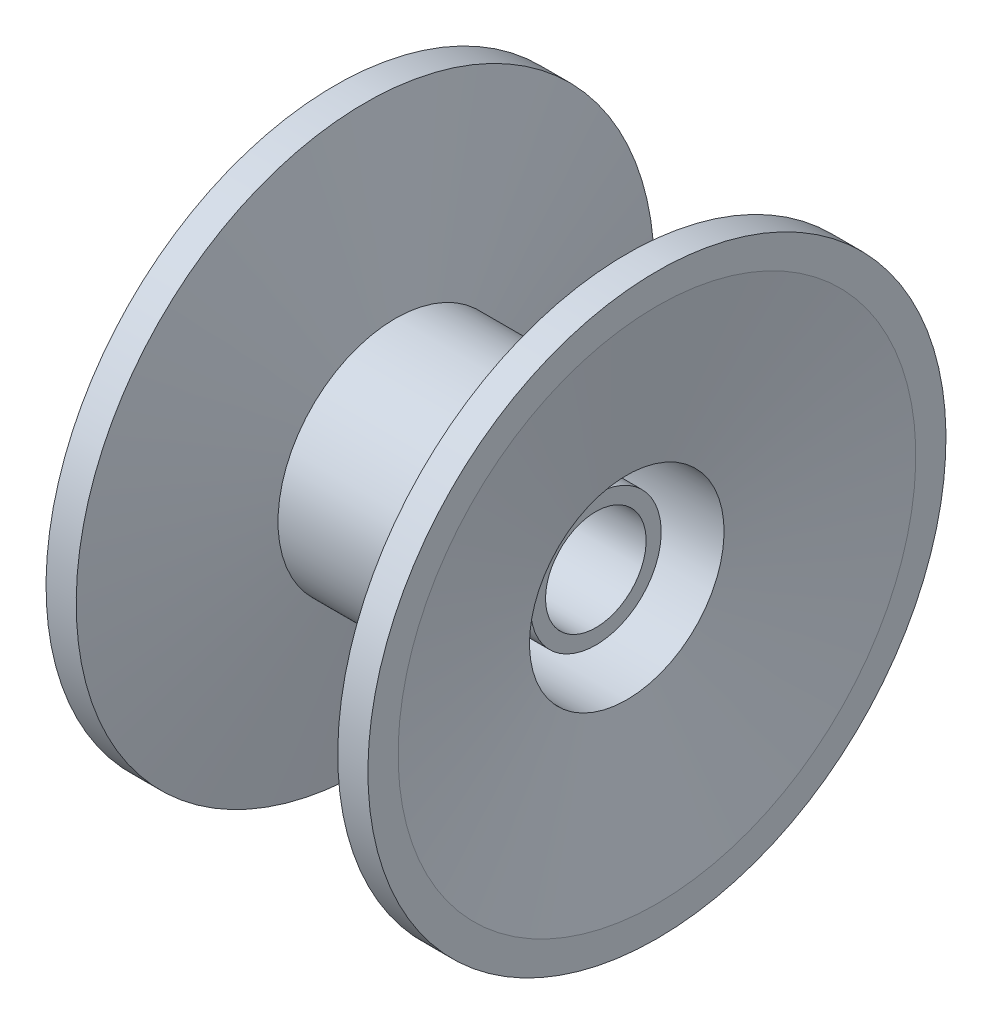
from build123d import *


with BuildPart() as part:
    # Sketch1 → Revolve1 (revolve)
    with BuildSketch(Plane.XY, mode=Mode.PRIVATE) as revolve1_sk:
        Polygon((-6.5, 14.366600049), (-8, 14.366600049), (-8, 12.866600049), (-6.5, 4.836166661), (0, 4.836166661), (0, 5.836166661), (-5, 5.836166661), align=None)
        Polygon((5, 5.836166661), (0, 5.836166661), (0, 4.836166661), (6.5, 4.836166661), (8, 12.866600049), (8, 14.366600049), (6.5, 14.366600049), align=None)
    revolve(revolve1_sk.sketch.rotate(Axis((-5, 0, 0), (1, 0, 0)), 180), axis=Axis((-5, 0, 0), (1, 0, 0)))


with BuildPart() as body_2:
    # Sketch2 → Revolve2 (revolve)
    with BuildSketch(Plane.XY, mode=Mode.PRIVATE) as revolve2_sk:
        with BuildLine():
            Line((-7.25, 8.851383355), (-7.112289713, 8.114134498))
            ThreePointArc((-7.112289713, 8.114134498), (-6.832493775, 6.236938002), (-6.288093085, 4.418757498))
            Line((-6.288093085, 4.418757498), (-6.288093085, 3.25))
            Line((-6.288093085, 3.25), (4.961906915, 3.25))
            Line((4.961906915, 3.25), (4.961906915, 2.5))
            Line((4.961906915, 2.5), (-4.788093085, 2.5))
            Line((-4.788093085, 2.5), (-4.788093085, 0))
            Line((-4.788093085, 0), (-5.538093085, 0))
            Line((-5.538093085, 0), (-5.538093085, 2.5))
            Line((-5.538093085, 2.5), (-7.038093085, 2.5))
            Line((-7.038093085, 2.5), (-7.602335642, 4.418757498))
            ThreePointArc((-7.602335642, 4.418757498), (-7.615169689, 6.650093597), (-7.25, 8.851383355))
        make_face()
    revolve(revolve2_sk.sketch.rotate(Axis((-5.538093085, 0, 0), (1, 0, 0)), 90), axis=Axis((-5.538093085, 0, 0), (1, 0, 0)))


solid = Compound([part.part, body_2.part])
